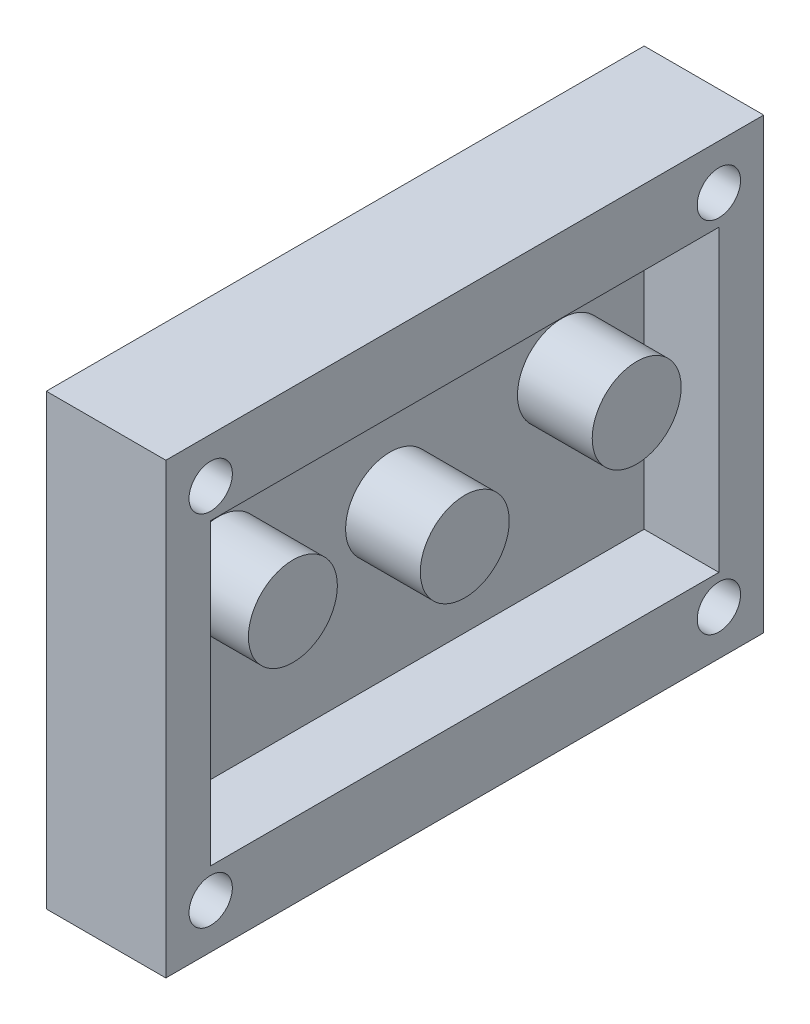
from build123d import *

# Parameters (mm, degrees)
SKETCH1_W           = 40
SKETCH1_H           = 30
BOSS_EXTRUDE1_DEPTH = 8
SKETCH4_R           = 1.45
SKETCH4_W           = 34
SKETCH4_H           = 20
CUT_EXTRUDE1_DEPTH  = 5
SKETCH5_R           = 2.975
BOSS_EXTRUDE2_DEPTH = 5


with BuildPart() as part:
    # Sketch1 → Boss-Extrude1 (new body)
    with BuildSketch(Plane(origin=(0, 0, 0), x_dir=(0, 0, -1), z_dir=(1, 0, 0))):
        with Locations((20, 15)):
            Rectangle(SKETCH1_W, SKETCH1_H)
    extrude(amount=BOSS_EXTRUDE1_DEPTH)

    # Sketch4 → Cut-Extrude1 (cut)
    with BuildSketch(Plane(origin=(8, 0, 0), x_dir=(0, 0, -1), z_dir=(1, 0, 0))):
        with Locations((37, 27)):
            Circle(SKETCH4_R)
        with Locations((3, 27)):
            Circle(SKETCH4_R)
        with Locations((3, 3)):
            Circle(SKETCH4_R)
        with Locations((37, 3)):
            Circle(SKETCH4_R)
        with Locations((20, 15)):
            Rectangle(SKETCH4_W, SKETCH4_H)
    extrude(amount=-CUT_EXTRUDE1_DEPTH, mode=Mode.SUBTRACT)

    # Sketch5 → Boss-Extrude2 (add)
    with BuildSketch(Plane(origin=(3, 0, 0), x_dir=(0, 0, -1), z_dir=(1, 0, 0))):
        with Locations(Location((8.5, 17, 0), (0, 0, 180))):
            Circle(SKETCH5_R)
        with Locations(Location((20, 15, 0), (0, 0, 180))):
            Circle(SKETCH5_R)
        with Locations(Location((31.5, 17, 0), (0, 0, 180))):
            Circle(SKETCH5_R)
    extrude(amount=BOSS_EXTRUDE2_DEPTH)


solid = part.part
